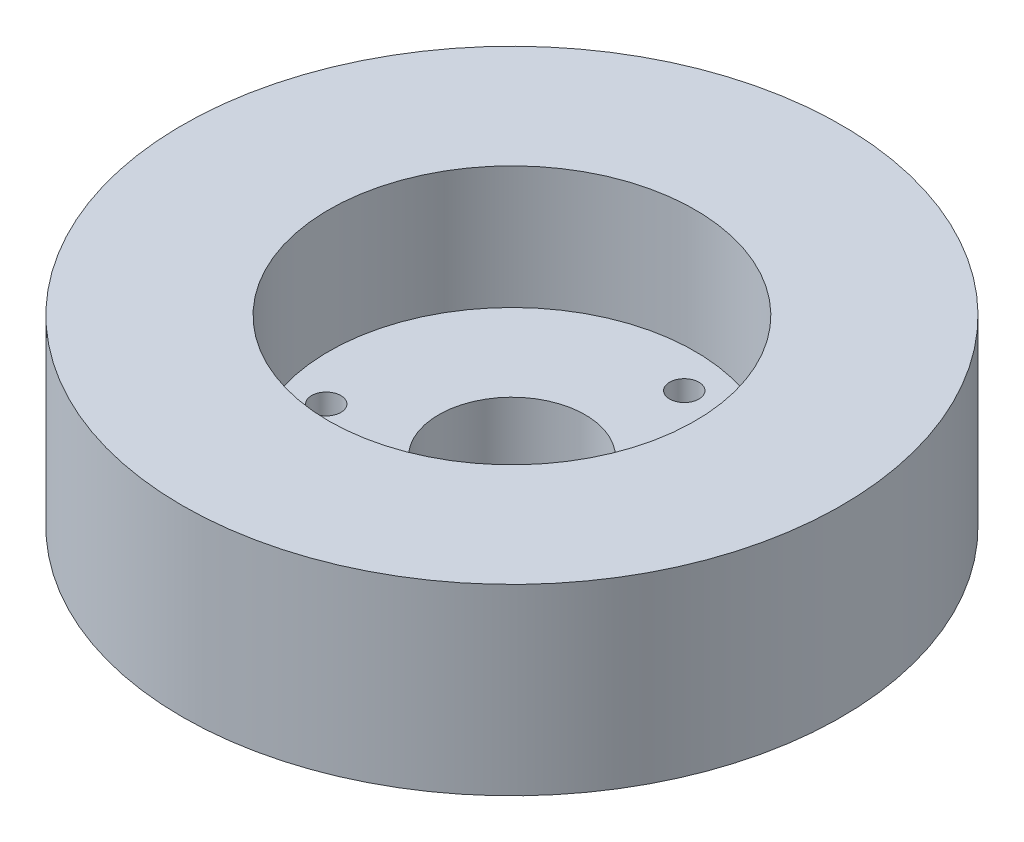
from build123d import *

# Parameters (mm, degrees)
SKETCH1_R           = 90
BOSS_EXTRUDE1_DEPTH = 50
SKETCH2_R           = 50
CUT_EXTRUDE1_DEPTH  = 33.5
SKETCH3_R           = 20
CUT_EXTRUDE2_DEPTH  = 35
SKETCH4_R           = 4
CUT_EXTRUDE3_DEPTH  = 72


with BuildPart() as part:
    # Sketch1 → Boss-Extrude1 (new body)
    with BuildSketch(Plane(origin=(0, 0, 0), x_dir=(1, 0, 0), z_dir=(0, 1, 0))):
        with Locations(Location((0, 0, 0), (0, 0, 270))):
            Circle(SKETCH1_R)
    extrude(amount=BOSS_EXTRUDE1_DEPTH)

    # Sketch2 → Cut-Extrude1 (cut)
    with BuildSketch(Plane(origin=(0, 50, 0), x_dir=(1, 0, 0), z_dir=(0, 1, 0))):
        with Locations(Location((0, 0, 0), (0, 0, 270))):
            Circle(SKETCH2_R)
    extrude(amount=-CUT_EXTRUDE1_DEPTH, mode=Mode.SUBTRACT)

    # Sketch3 → Cut-Extrude2 (cut)
    with BuildSketch(Plane(origin=(0, 16.5, 0), x_dir=(1, 0, 0), z_dir=(0, 1, 0))):
        with Locations(Location((0, 0, 0), (0, 0, 270))):
            Circle(SKETCH3_R)
    extrude(amount=-CUT_EXTRUDE2_DEPTH, mode=Mode.SUBTRACT)

    # Sketch4 → Cut-Extrude3 (cut)
    with BuildSketch(Plane.XZ):
        with Locations(Location((-37.889173801, 12.822266129, 0), (0, 0, 270))):
            Circle(SKETCH4_R)
        with Locations(Location((7.840178699, -39.224120105, 0), (0, 0, 270))):
            Circle(SKETCH4_R)
        with Locations(Location((30.048995102, 26.401853976, 0), (0, 0, 270))):
            Circle(SKETCH4_R)
    extrude(amount=-CUT_EXTRUDE3_DEPTH, mode=Mode.SUBTRACT)


solid = part.part
